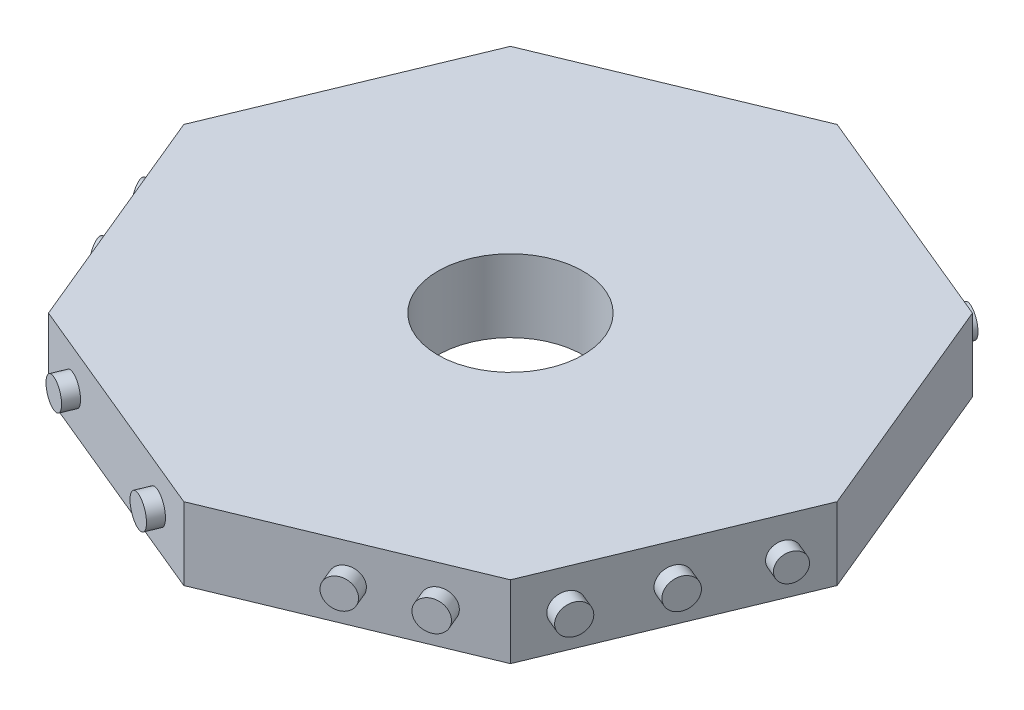
from build123d import *

# Parameters (mm, degrees)
BOSS_EXTRUDE1_DEPTH      = 12.7
SKETCH6_R                = 2.582336278
BOSS_EXTRUDE5_DEPTH      = 2.54
SKETCH8_R                = 2.650649738
BOSS_EXTRUDE7_DEPTH      = 2.54
SKETCH9_R                = 2.655151376
BOSS_EXTRUDE8_DEPTH      = 2.54
BOSS_EXTRUDE9_DEPTH      = 2.54
BOSS_EXTRUDE9_DEPTH_BACK = 2.032
SKETCH10_R               = 2.513561162
SKETCH11_R               = 2.58621177
BOSS_EXTRUDE10_DEPTH     = 2.54
SKETCH12_R               = 2.635427952
BOSS_EXTRUDE11_DEPTH     = 2.54
SKETCH13_R               = 2.610060734
BOSS_EXTRUDE12_DEPTH     = 2.54
SKETCH14_R               = 2.635257061
BOSS_EXTRUDE13_DEPTH     = 2.54
SKETCH15_R               = 2.496375984
BOSS_EXTRUDE14_DEPTH     = 2.54
SKETCH16_R               = 2.621965254
BOSS_EXTRUDE15_DEPTH     = 2.54
SKETCH17_R               = 2.649584499
BOSS_EXTRUDE16_DEPTH     = 2.54
SKETCH18_R               = 2.417668351
BOSS_EXTRUDE17_DEPTH     = 2.54
SKETCH25_R               = 12.696845274
CUT_EXTRUDE1_DEPTH       = 12.954


with BuildPart() as part:
    # Sketch2 → Boss-Extrude1 (new body)
    with BuildSketch(Plane(origin=(0, 0, 0), x_dir=(1, 0, 0), z_dir=(0, 1, 0))):
        Polygon((57.113851186, 0), (40.385591473, 40.385591473), (0, 57.113851186), (-40.385591473, 40.385591473), (-57.113851186, 0), (-40.385591473, -40.385591473), (0, -57.113851186), (40.385591473, -40.385591473), align=None)
    extrude(amount=BOSS_EXTRUDE1_DEPTH)

    # Sketch6 → Boss-Extrude5 (add)
    with BuildSketch(Plane(origin=(20.192795737, 0, 48.749721329), x_dir=(0.9238795325112822, 0, -0.38268343236510083), z_dir=(0.38268343236510083, 0, 0.9238795325112822))):
        with Locations(Location((0, 6.35, 0), (0, 0, 180))):
            Circle(SKETCH6_R)
    extrude(amount=BOSS_EXTRUDE5_DEPTH)

    # Sketch8 → Boss-Extrude7 (add)
    with BuildSketch(Plane(origin=(20.192795737, 0, 48.749721329), x_dir=(0.9238795325112822, 0, -0.38268343236510083), z_dir=(0.38268343236510083, 0, 0.9238795325112822))):
        with Locations(Location((12.369517224, 6.35, 0), (0, 0, 180))):
            Circle(SKETCH8_R)
    extrude(amount=BOSS_EXTRUDE7_DEPTH)

    # Sketch9 → Boss-Extrude8 (add)
    with BuildSketch(Plane(origin=(-20.192795737, 0, 48.749721329), x_dir=(0.9238795325112911, 0, 0.38268343236507935), z_dir=(-0.38268343236507935, 0, 0.9238795325112911))):
        with Locations(Location((13.282722146, 6.35, 0), (0, 0, 180))):
            Circle(SKETCH9_R)
    extrude(amount=BOSS_EXTRUDE8_DEPTH)

    # Sketch10 → Boss-Extrude9 (add, two sides: drawn at the far end of the back side and taken through both)
    with BuildSketch(Plane(origin=(-20.192795737, 0, 48.749721329), x_dir=(0.9238795325112911, 0, 0.38268343236507935), z_dir=(-0.38268343236507935, 0, 0.9238795325112911)).offset(-BOSS_EXTRUDE9_DEPTH_BACK)):
        with Locations(Location((-14.008863044, 6.35, 0), (0, 0, 180))):
            Circle(SKETCH10_R)
    extrude(amount=BOSS_EXTRUDE9_DEPTH + BOSS_EXTRUDE9_DEPTH_BACK)

    # Sketch11 → Boss-Extrude10 (add)
    with BuildSketch(Plane(origin=(-48.749721329, 0, 20.192795737), x_dir=(0.3826834323651003, 0, 0.9238795325112825), z_dir=(-0.9238795325112825, 0, 0.3826834323651003))):
        with Locations(Location((-13.637069306, 6.35, 0), (0, 0, 180))):
            Circle(SKETCH11_R)
    extrude(amount=BOSS_EXTRUDE10_DEPTH)

    # Sketch12 → Boss-Extrude11 (add)
    with BuildSketch(Plane(origin=(-48.749721329, 0, 20.192795737), x_dir=(0.3826834323651003, 0, 0.9238795325112825), z_dir=(-0.9238795325112825, 0, 0.3826834323651003))):
        with Locations(Location((0, 6.35, 0), (0, 0, 180))):
            Circle(SKETCH12_R)
    extrude(amount=BOSS_EXTRUDE11_DEPTH)

    # Sketch13 → Boss-Extrude12 (add)
    with BuildSketch(Plane(origin=(-48.749721329, 0, -20.192795737), x_dir=(-0.38268343236507907, 0, 0.9238795325112913), z_dir=(-0.9238795325112913, 0, -0.38268343236507907))):
        with Locations(Location((14.354264816, 6.35, 0), (0, 0, 180))):
            Circle(SKETCH13_R)
    extrude(amount=BOSS_EXTRUDE12_DEPTH)

    # Sketch14 → Boss-Extrude13 (add)
    with BuildSketch(Plane(origin=(-20.192795737, 0, -48.749721329), x_dir=(-0.9238795325112825, 0, 0.3826834323651002), z_dir=(-0.3826834323651002, 0, -0.9238795325112825))):
        with Locations(Location((0, 6.35, 0), (0, 0, 180))):
            Circle(SKETCH14_R)
    extrude(amount=BOSS_EXTRUDE13_DEPTH)

    # Sketch15 → Boss-Extrude14 (add)
    with BuildSketch(Plane(origin=(20.192795737, 0, -48.749721329), x_dir=(-0.9238795325112913, 0, -0.38268343236507896), z_dir=(0.3826834323650789, 0, -0.9238795325112912))):
        with Locations(Location((-15.021400656, 6.35, 0), (0, 0, 180))):
            Circle(SKETCH15_R)
    extrude(amount=BOSS_EXTRUDE14_DEPTH)

    # Sketch16 → Boss-Extrude15 (add)
    with BuildSketch(Plane(origin=(48.749721329, 0, 20.192795737), x_dir=(0.3826834323650791, 0, -0.9238795325112912), z_dir=(0.9238795325112913, 0, 0.3826834323650792))):
        with Locations(Location((-14.377366693, 6.35, 0), (0, 0, 180))):
            Circle(SKETCH16_R)
    extrude(amount=BOSS_EXTRUDE15_DEPTH)

    # Sketch17 → Boss-Extrude16 (add)
    with BuildSketch(Plane(origin=(48.749721329, 0, 20.192795737), x_dir=(0.3826834323650791, 0, -0.9238795325112912), z_dir=(0.9238795325112913, 0, 0.3826834323650792))):
        with Locations(Location((0, 6.35, 0), (0, 0, 180))):
            Circle(SKETCH17_R)
    extrude(amount=BOSS_EXTRUDE16_DEPTH)

    # Sketch18 → Boss-Extrude17 (add)
    with BuildSketch(Plane(origin=(48.749721329, 0, 20.192795737), x_dir=(0.3826834323650791, 0, -0.9238795325112912), z_dir=(0.9238795325112913, 0, 0.3826834323650792))):
        with Locations(Location((14.696818613, 6.35, 0), (0, 0, 180))):
            Circle(SKETCH18_R)
    extrude(amount=BOSS_EXTRUDE17_DEPTH)

    # Sketch25 → Cut-Extrude1 (cut)
    with BuildSketch(Plane(origin=(0, 12.7, 0), x_dir=(1, 0, 0), z_dir=(0, 1, 0))):
        with Locations(Location((0, 0, 0), (0, 0, 270))):
            Circle(SKETCH25_R)
    extrude(amount=-CUT_EXTRUDE1_DEPTH, mode=Mode.SUBTRACT)


solid = part.part
